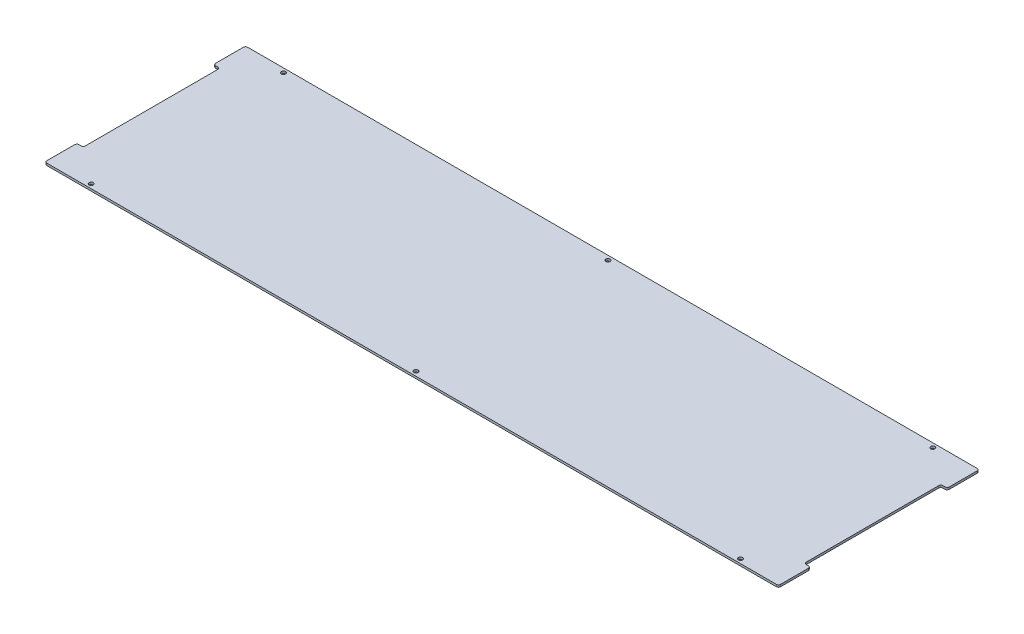
from build123d import *

# Parameters (mm, degrees)
SKETCH1_W                   = 1090.6125
SKETCH1_H                   = 298.45
BOSS_EXTRUDE1_DEPTH         = 3.175
SKETCH2_W                   = 9.525
SKETCH2_H                   = 203.2
CUT_EXTRUDE1_DEPTH          = 566.364561623
FILLET1_R                   = 3.175
FILLET1_OF_MIRROR1_R        = 3.175
F_1_4_0_25_DIAMETER_HOLE1_D = 6.35
FILLET2_R                   = 3.175


with BuildPart() as part:
    # Sketch1 → Boss-Extrude1 (new body)
    with BuildSketch(Plane(origin=(0, 0, 0), x_dir=(1, 0, 0), z_dir=(0, 1, 0))):
        Rectangle(SKETCH1_W, SKETCH1_H)
    extrude(amount=BOSS_EXTRUDE1_DEPTH)

    # Sketch2 → Cut-Extrude1 (cut, through all)
    with BuildSketch(Plane(origin=(0, 3.175, 0), x_dir=(1, 0, 0), z_dir=(0, 1, 0))):
        with Locations((540.54375, 0)):
            Rectangle(SKETCH2_W, SKETCH2_H)
    cut_extrude1 = extrude(amount=-CUT_EXTRUDE1_DEPTH, mode=Mode.SUBTRACT)

    # Fillet1
    fillet1_edges = [part.edges().sort_by_distance(p)[0] for p in [
        (535.78125, 1.5875, 101.6),
        (535.78125, 1.5875, -101.6),
    ]]
    fillet(fillet1_edges, radius=FILLET1_R)

    # Mirror1: Cut-Extrude1 across plane
    add(cut_extrude1.mirror(Plane(origin=(0, 0, 0), x_dir=(0, 0, 1), z_dir=(1, 0, 0))), mode=Mode.SUBTRACT)

    # Fillet1 of Mirror1
    fillet1_of_mirror1_edges = [part.edges().sort_by_distance(p)[0] for p in [
        (-535.78125, 1.5875, 101.6),
        (-535.78125, 1.5875, -101.6),
    ]]
    fillet(fillet1_of_mirror1_edges, radius=FILLET1_OF_MIRROR1_R)

    # 1/4 (0.25) Diameter Hole1 (through all)
    with Locations(Plane(origin=(0, 3.175, 0), x_dir=(1, 0, 0), z_dir=(0, 1, 0))):
        with Locations((482.6, 142.875), (0, 142.875), (-482.6, 142.875)):
            f_1_4_0_25_diameter_hole1 = Hole(F_1_4_0_25_DIAMETER_HOLE1_D / 2)

    # Mirror2: 1/4 (0.25) Diameter Hole1 across plane
    add(f_1_4_0_25_diameter_hole1.mirror(Plane.XY), mode=Mode.SUBTRACT)

    # Fillet2
    fillet2_edges = [part.edges().sort_by_distance(p)[0] for p in [
        (545.30625, 1.5875, -101.6),
        (545.30625, 1.5875, 101.6),
        (-545.30625, 1.5875, 101.6),
        (-545.30625, 1.5875, -101.6),
        (545.30625, 1.5875, 149.225),
        (-545.30625, 1.5875, 149.225),
        (-545.30625, 1.5875, -149.225),
        (545.30625, 1.5875, -149.225),
    ]]
    fillet(fillet2_edges, radius=FILLET2_R)


solid = part.part
